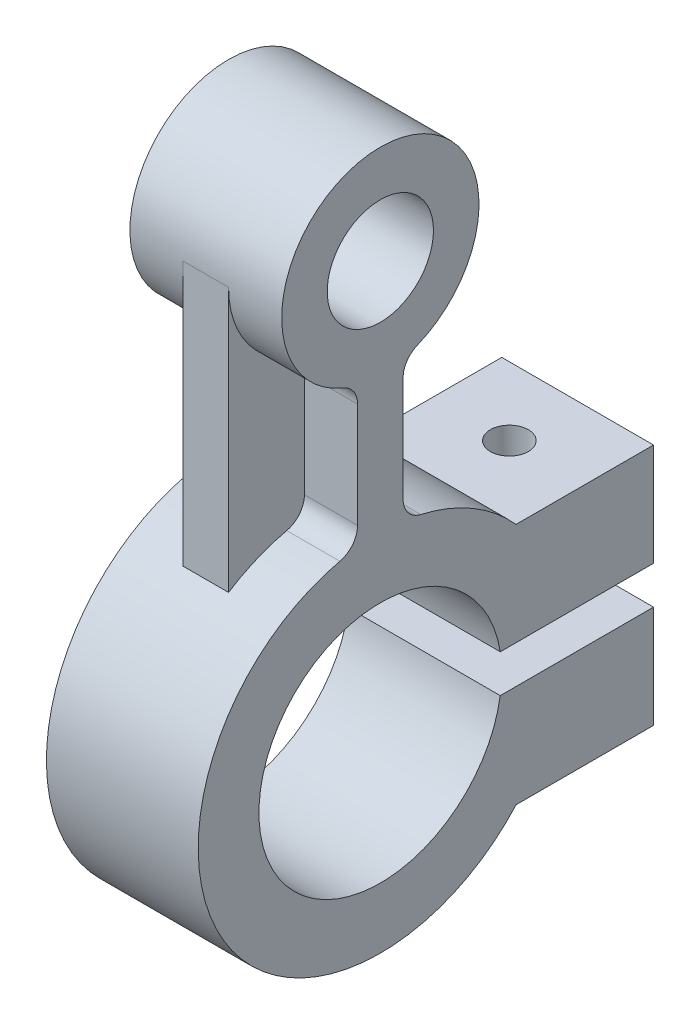
from build123d import *

# Parameters (mm, degrees)
SKETCH1_R           = 7
BOSS_EXTRUDE1_DEPTH = 10
RIB1_REACH          = 79.589
SKETCH2_WALL_W      = 192.003076928
SKETCH2_WALL_H      = 6
SKETCH3_R           = 2.5
CUT_EXTRUDE1_DEPTH  = 65.031242374


with BuildPart() as part:
    # Sketch1 → Boss-Extrude1 (new, symmetric)
    with BuildSketch(Plane.YZ):
        with BuildLine():
            Line((26.324893162, 3), (40.167603026, 3))
            ThreePointArc((40.167603026, 3), (41.844654009, 3.512531407), (42.948677458, 4.875))
            ThreePointArc((42.948677458, 4.875), (68, 0), (42.948677458, -4.875))
            ThreePointArc((42.948677458, -4.875), (41.844654009, -3.512531407), (40.167603026, -3))
            Line((40.167603026, -3), (26.324893162, -3))
            ThreePointArc((26.324893162, -3), (24.454064469, -3.65479212), (23.399905033, -5.333333333))
            ThreePointArc((23.399905033, -5.333333333), (20.675987443, -12.186202988), (16, -17.88854382))
            Line((16, -17.88854382), (16, -36))
            Line((16, -36), (2.5, -36))
            Line((2.5, -36), (2.5, -15.803480629))
            ThreePointArc((2.5, -15.803480629), (0, 16), (-2.5, -15.803480629))
            Line((-2.5, -15.803480629), (-2.5, -36))
            Line((-2.5, -36), (-16, -36))
            Line((-16, -36), (-16, -17.88854382))
            ThreePointArc((-16, -17.88854382), (-12.186202988, 20.675987443), (23.399905033, 5.333333333))
            ThreePointArc((23.399905033, 5.333333333), (24.454064469, 3.65479212), (26.324893162, 3))
        make_face()
        with Locations(Location((55, 0, 0), (0, 0, 270))):
            Circle(SKETCH1_R, mode=Mode.SUBTRACT)
    extrude(amount=BOSS_EXTRUDE1_DEPTH, both=True)

    # Sketch2 wall → Rib1 (add, up to next)
    with BuildSketch(Plane(origin=(0, 37.587120501, 13), x_dir=(0, -1, 0), z_dir=(0, 0, -1)), mode=Mode.PRIVATE) as rib1_sk1:
        Rectangle(SKETCH2_WALL_W, SKETCH2_WALL_H)
    rib1_tool1 = extrude(rib1_sk1.sketch, amount=RIB1_REACH, mode=Mode.PRIVATE) - part.part
    add(rib1_tool1.solids().sort_by_distance((0, 37.587120501, 13))[0])

    # Sketch3 → Cut-Extrude1 (cut, through all)
    with BuildSketch(Plane(origin=(0, 16, 0), x_dir=(-1, 0, 0), z_dir=(0, 1, 0))):
        with Locations(Location((0, -27, 0), (0, 0, 90))):
            Circle(SKETCH3_R)
    extrude(amount=-CUT_EXTRUDE1_DEPTH, mode=Mode.SUBTRACT)


solid = part.part
